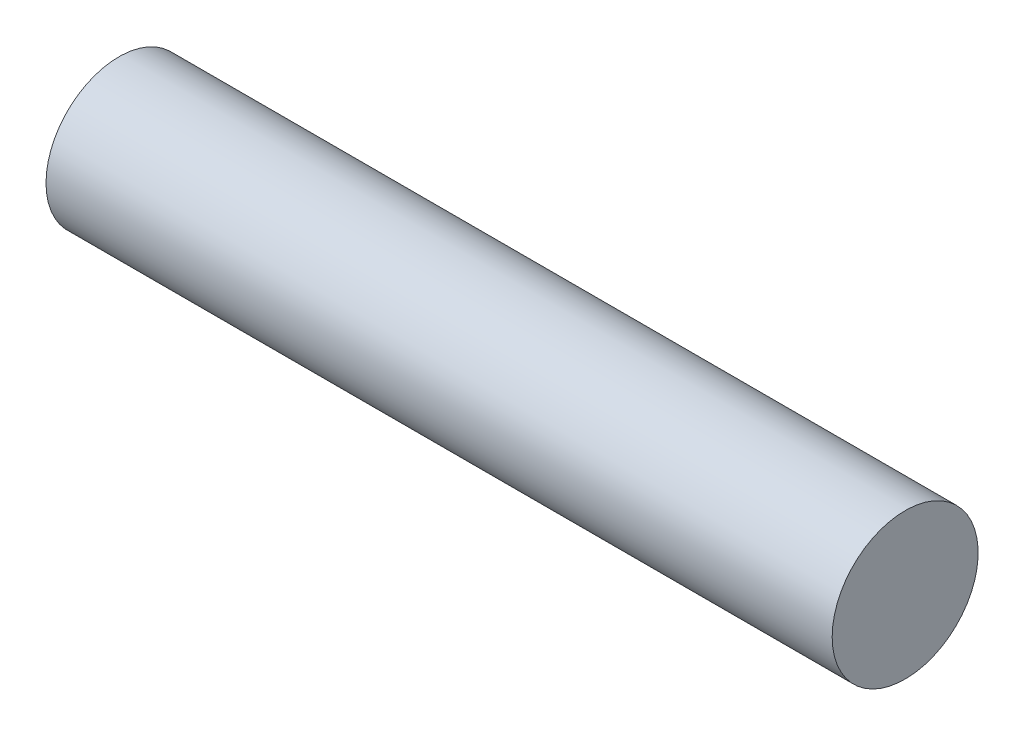
from build123d import *

# Parameters (mm, degrees)
ESQUISSE1_W = 476.853743392
ESQUISSE1_H = 44.271024872


with BuildPart() as part:
    # Esquisse1 → Révolution1 (revolve)
    with BuildSketch(Plane.XY, mode=Mode.PRIVATE) as r_volution1_sk:
        with Locations((-272.618717632, 16.895855249)):
            Rectangle(ESQUISSE1_W, ESQUISSE1_H)
    revolve(r_volution1_sk.sketch.rotate(Axis((-511.045589328, -5.239657187, 0), (1, 0, 0)), 90), axis=Axis((-511.045589328, -5.239657187, 0), (1, 0, 0)))


solid = part.part
